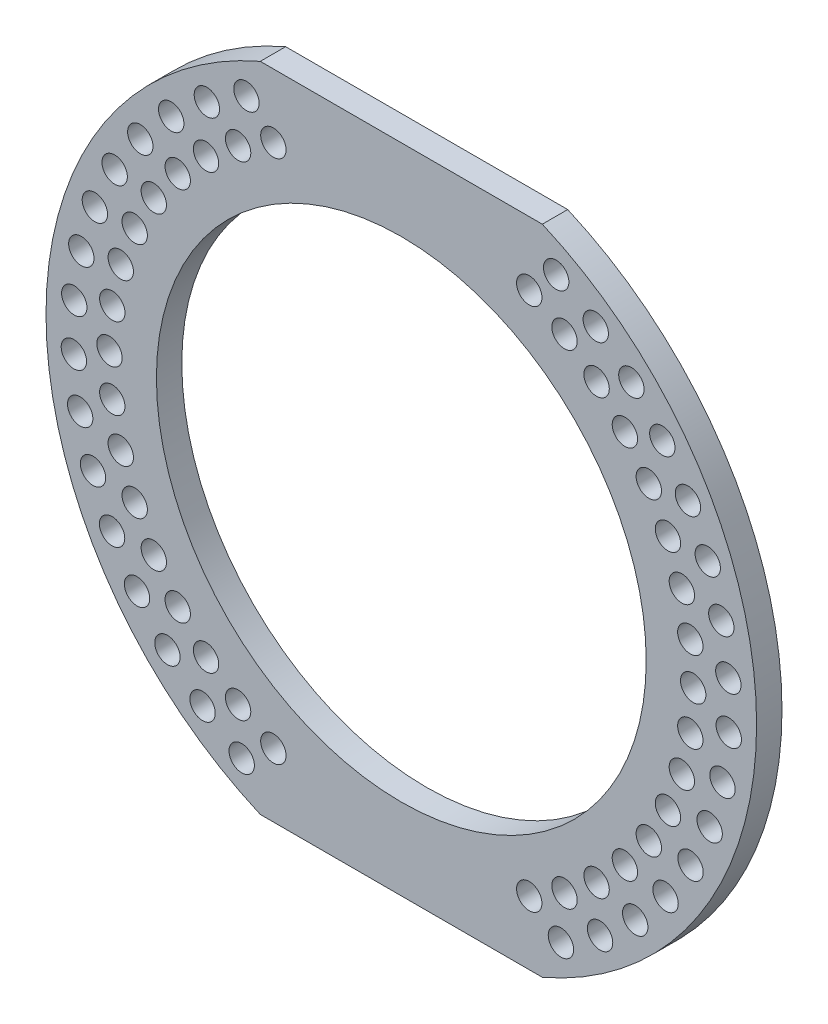
from build123d import *

# Parameters (mm, degrees)
Y_KSEKLIK_EKSTR_ZYON1_DEPTH = 2
IZIM2_R                     = 19.3
KES_EKSTR_ZYON1_DEPTH       = 3
IZIM3_R                     = 1
KES_EKSTR_ZYON2_DEPTH       = 3
IZIM4_R                     = 1
KES_EKSTR_ZYON3_DEPTH       = 3


with BuildPart() as part:
    # Çizim1 → Yükseklik-Ekstrüzyon1 (new body)
    with BuildSketch(Plane.XY):
        with BuildLine():
            Line((-11.113505298, 25.7), (11.113505298, 25.7))
            ThreePointArc((11.113505298, 25.7), (28, 0), (11.113505298, -25.7))
            Line((11.113505298, -25.7), (-11.113505298, -25.7))
            ThreePointArc((-11.113505298, -25.7), (-28, 0), (-11.113505298, 25.7))
        make_face()
    extrude(amount=Y_KSEKLIK_EKSTR_ZYON1_DEPTH)

    # Çizim2 → Kes-Ekstrüzyon1 (cut)
    with BuildSketch(Plane.XY.offset(2)):
        Circle(IZIM2_R)
    extrude(amount=-KES_EKSTR_ZYON1_DEPTH, mode=Mode.SUBTRACT)

    # Çizim3 → Kes-Ekstrüzyon2 (cut)
    with BuildSketch(Plane.XY.offset(2)):
        with Locations((-23, 0)):
            Circle(IZIM3_R)
        with Locations((-22.776165581, 3.200981322)):
            Circle(IZIM3_R)
        with Locations((-22.109019007, 6.339659184)):
            Circle(IZIM3_R)
        with Locations((-21.011545526, 9.354942791)):
            Circle(IZIM3_R)
        with Locations((-19.505106212, 12.188143077)):
            Circle(IZIM3_R)
        with Locations((-17.619022192, 14.784115023)):
            Circle(IZIM3_R)
        with Locations((-15.390003946, 17.092330986)):
            Circle(IZIM3_R)
        with Locations((-12.86143678, 19.067864169)):
            Circle(IZIM3_R)
        with Locations((-10.082536376, 20.672263065)):
            Circle(IZIM3_R)
        with Locations((-10.082536376, -20.672263065)):
            Circle(IZIM3_R)
        with Locations((-12.86143678, -19.067864169)):
            Circle(IZIM3_R)
        with Locations((-15.390003946, -17.092330986)):
            Circle(IZIM3_R)
        with Locations((-17.619022192, -14.784115023)):
            Circle(IZIM3_R)
        with Locations((-19.505106212, -12.188143077)):
            Circle(IZIM3_R)
        with Locations((-21.011545526, -9.354942791)):
            Circle(IZIM3_R)
        with Locations((-22.109019007, -6.339659184)):
            Circle(IZIM3_R)
        with Locations((-22.776165581, -3.200981322)):
            Circle(IZIM3_R)
        with Locations((10.082536376, -20.672263065)):
            Circle(IZIM3_R)
        with Locations((12.86143678, -19.067864169)):
            Circle(IZIM3_R)
        with Locations((15.390003946, -17.092330986)):
            Circle(IZIM3_R)
        with Locations((17.619022192, -14.784115023)):
            Circle(IZIM3_R)
        with Locations((19.505106212, -12.188143077)):
            Circle(IZIM3_R)
        with Locations((21.011545526, -9.354942791)):
            Circle(IZIM3_R)
        with Locations((22.109019007, -6.339659184)):
            Circle(IZIM3_R)
        with Locations((22.776165581, -3.200981322)):
            Circle(IZIM3_R)
        with Locations((23, 0)):
            Circle(IZIM3_R)
        with Locations((22.776165581, 3.200981322)):
            Circle(IZIM3_R)
        with Locations((22.109019007, 6.339659184)):
            Circle(IZIM3_R)
        with Locations((21.011545526, 9.354942791)):
            Circle(IZIM3_R)
        with Locations((19.505106212, 12.188143077)):
            Circle(IZIM3_R)
        with Locations((17.619022192, 14.784115023)):
            Circle(IZIM3_R)
        with Locations((15.390003946, 17.092330986)):
            Circle(IZIM3_R)
        with Locations((12.86143678, 19.067864169)):
            Circle(IZIM3_R)
        with Locations((10.082536376, 20.672263065)):
            Circle(IZIM3_R)
    extrude(amount=-KES_EKSTR_ZYON2_DEPTH, mode=Mode.SUBTRACT)

    # Çizim4 → Kes-Ekstrüzyon3 (cut)
    with BuildSketch(Plane.XY.offset(2)):
        with Locations((-12.20385672, 22.793583408)):
            Circle(IZIM4_R)
        with Locations((-12.577279495, -22.589679146)):
            Circle(IZIM4_R)
        with Locations((-15.664107459, -20.569815287)):
            Circle(IZIM4_R)
        with Locations((-18.432059367, -18.131209307)):
            Circle(IZIM4_R)
        with Locations((-20.8247877, -15.323504191)):
            Circle(IZIM4_R)
        with Locations((-22.793583408, -12.20385672)):
            Circle(IZIM4_R)
        with Locations((-24.29836749, -8.835773918)):
            Circle(IZIM4_R)
        with Locations((-25.308506881, -5.28782024)):
            Circle(IZIM4_R)
        with Locations((-25.803438055, -1.632221791)):
            Circle(IZIM4_R)
        with Locations((-25.773085641, 2.056603987)):
            Circle(IZIM4_R)
        with Locations((-25.218067527, 5.703563239)):
            Circle(IZIM4_R)
        with Locations((-24.149682281, 9.234414391)):
            Circle(IZIM4_R)
        with Locations((-22.589679146, 12.577279495)):
            Circle(IZIM4_R)
        with Locations((-20.569815287, 15.664107459)):
            Circle(IZIM4_R)
        with Locations((-18.131209307, 18.432059367)):
            Circle(IZIM4_R)
        with Locations((-15.323504191, 20.8247877)):
            Circle(IZIM4_R)
        with Locations((12.577279495, -22.589679146)):
            Circle(IZIM4_R)
        with Locations((15.664107459, -20.569815287)):
            Circle(IZIM4_R)
        with Locations((18.432059367, -18.131209307)):
            Circle(IZIM4_R)
        with Locations((20.8247877, -15.323504191)):
            Circle(IZIM4_R)
        with Locations((22.793583408, -12.20385672)):
            Circle(IZIM4_R)
        with Locations((24.29836749, -8.835773918)):
            Circle(IZIM4_R)
        with Locations((25.308506881, -5.28782024)):
            Circle(IZIM4_R)
        with Locations((25.803438055, -1.632221791)):
            Circle(IZIM4_R)
        with Locations((25.773085641, 2.056603987)):
            Circle(IZIM4_R)
        with Locations((25.218067527, 5.703563239)):
            Circle(IZIM4_R)
        with Locations((24.149682281, 9.234414391)):
            Circle(IZIM4_R)
        with Locations((22.589679146, 12.577279495)):
            Circle(IZIM4_R)
        with Locations((20.569815287, 15.664107459)):
            Circle(IZIM4_R)
        with Locations((18.131209307, 18.432059367)):
            Circle(IZIM4_R)
        with Locations((15.323504191, 20.8247877)):
            Circle(IZIM4_R)
        with Locations((12.20385672, 22.793583408)):
            Circle(IZIM4_R)
    extrude(amount=-KES_EKSTR_ZYON3_DEPTH, mode=Mode.SUBTRACT)


solid = part.part
